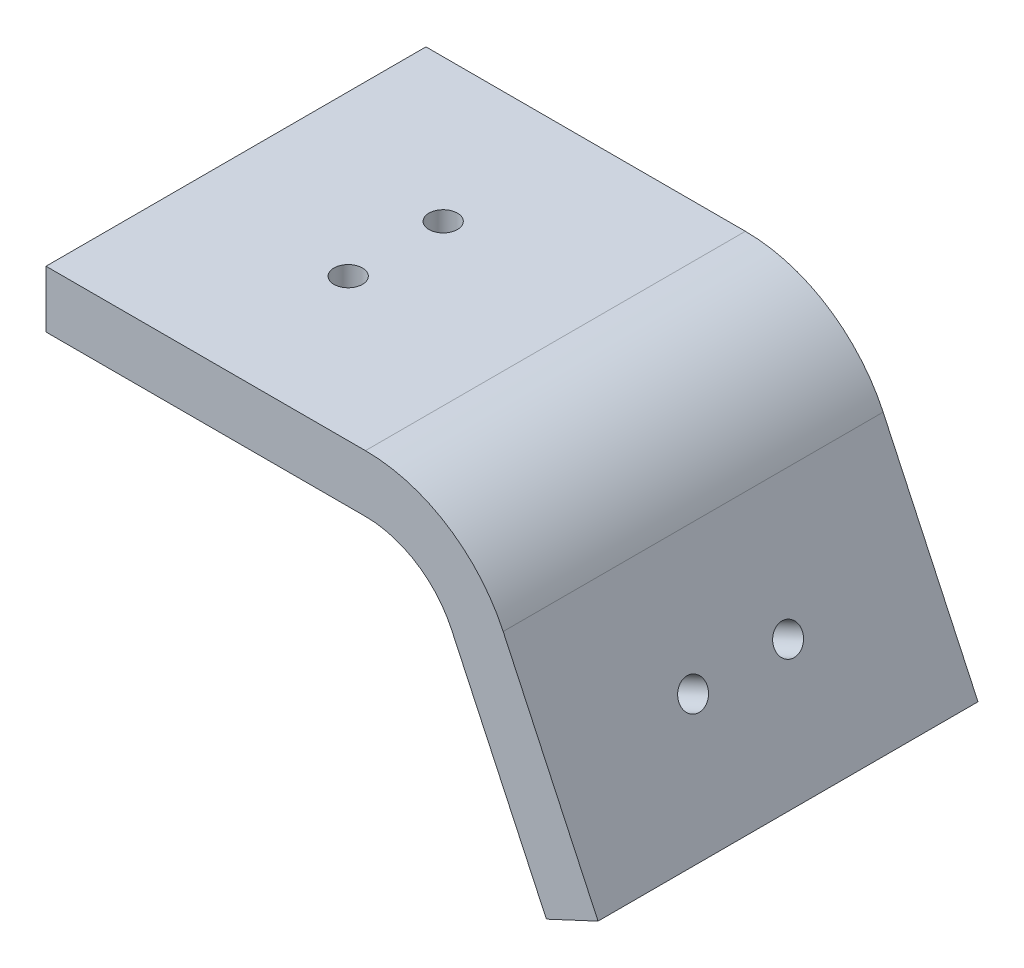
from build123d import *

# Parameters (mm, degrees)
BOSS_EXTRUDE1_DEPTH = 40
SKETCH2_R           = 1.5
CUT_EXTRUDE1_DEPTH  = 40
SKETCH3_R           = 1.5
CUT_EXTRUDE2_DEPTH  = 40


with BuildPart() as part:
    # Sketch1 → Boss-Extrude1 (new body)
    with BuildSketch(Plane.XY):
        with BuildLine():
            Line((0, 0), (-9.98617259, 21.415416229))
            ThreePointArc((-9.98617259, 21.415416229), (-13.676254377, 25.623148069), (-19.04925046, 27.189233611))
            Line((-19.04925046, 27.189233611), (-52.678547852, 27.189233611))
            Line((-52.678547852, 27.189233611), (-52.678547852, 33.189233611))
            Line((-52.678547852, 33.189233611), (-19.04925046, 33.189233611))
            ThreePointArc((-19.04925046, 33.189233611), (-10.452456727, 30.683496744), (-4.548325868, 23.951125799))
            Line((-4.548325868, 23.951125799), (5.437846722, 2.53570957))
            Line((5.437846722, 2.53570957), (0, 0))
        make_face()
    extrude(amount=BOSS_EXTRUDE1_DEPTH)

    # Sketch2 → Cut-Extrude1 (cut)
    with BuildSketch(Plane(origin=(0, 33.189233611, 0), x_dir=(1, 0, 0), z_dir=(0, 1, 0))):
        with Locations(Location((-35.863899156, -15, 0), (0, 0, 270))):
            Circle(SKETCH2_R)
        with Locations(Location((-35.863899156, -25, 0), (0, 0, 270))):
            Circle(SKETCH2_R)
    extrude(amount=-CUT_EXTRUDE1_DEPTH, mode=Mode.SUBTRACT)

    # Sketch3 → Cut-Extrude2 (cut)
    with BuildSketch(Plane(origin=(5.437846722, 2.53570957, 0), x_dir=(0, 0, -1), z_dir=(0.906307787036651, 0.42261826174069705, 0))):
        with Locations(Location((-15, 11.814648696, 0), (0, 0, 90))):
            Circle(SKETCH3_R)
        with Locations(Location((-25, 11.814648696, 0), (0, 0, 90))):
            Circle(SKETCH3_R)
    extrude(amount=-CUT_EXTRUDE2_DEPTH, mode=Mode.SUBTRACT)


solid = part.part
